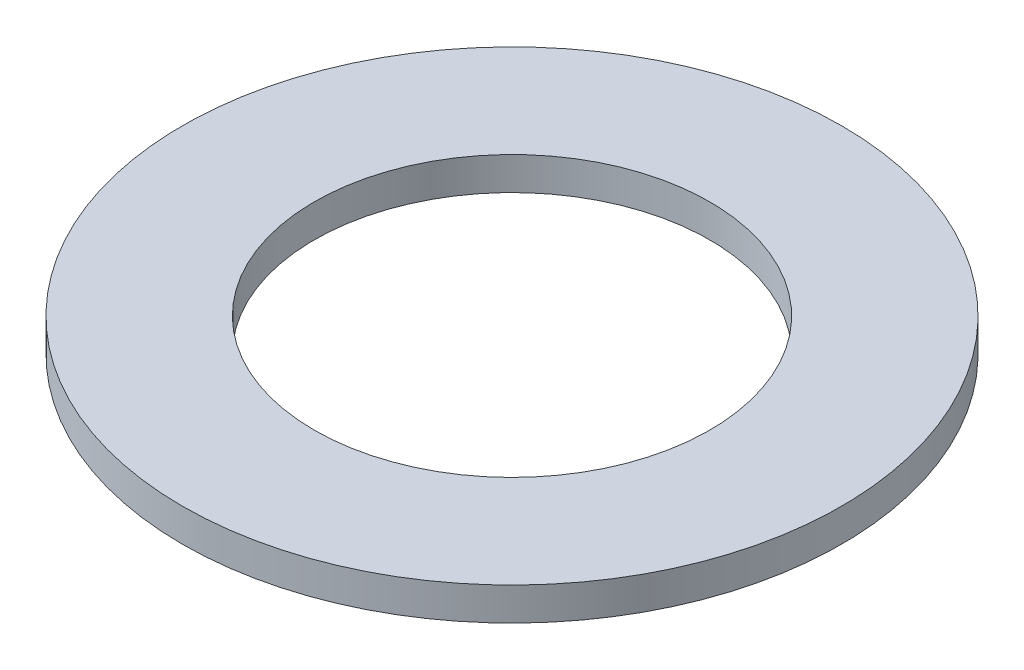
from build123d import *

# Parameters (mm, degrees)
SKETCH1_R           = 10
SKETCH1_R_2         = 6.0005
BOSS_EXTRUDE1_DEPTH = 1


with BuildPart() as part:
    # Sketch1 → Boss-Extrude1 (new body)
    with BuildSketch(Plane(origin=(0, 0, 0), x_dir=(1, 0, 0), z_dir=(0, 1, 0))):
        with Locations(Location((0, 0, 0), (0, 0, 270))):
            Circle(SKETCH1_R)
        with Locations(Location((0, 0, 0), (0, 0, 270))):
            Circle(SKETCH1_R_2, mode=Mode.SUBTRACT)
    extrude(amount=BOSS_EXTRUDE1_DEPTH)


solid = part.part
